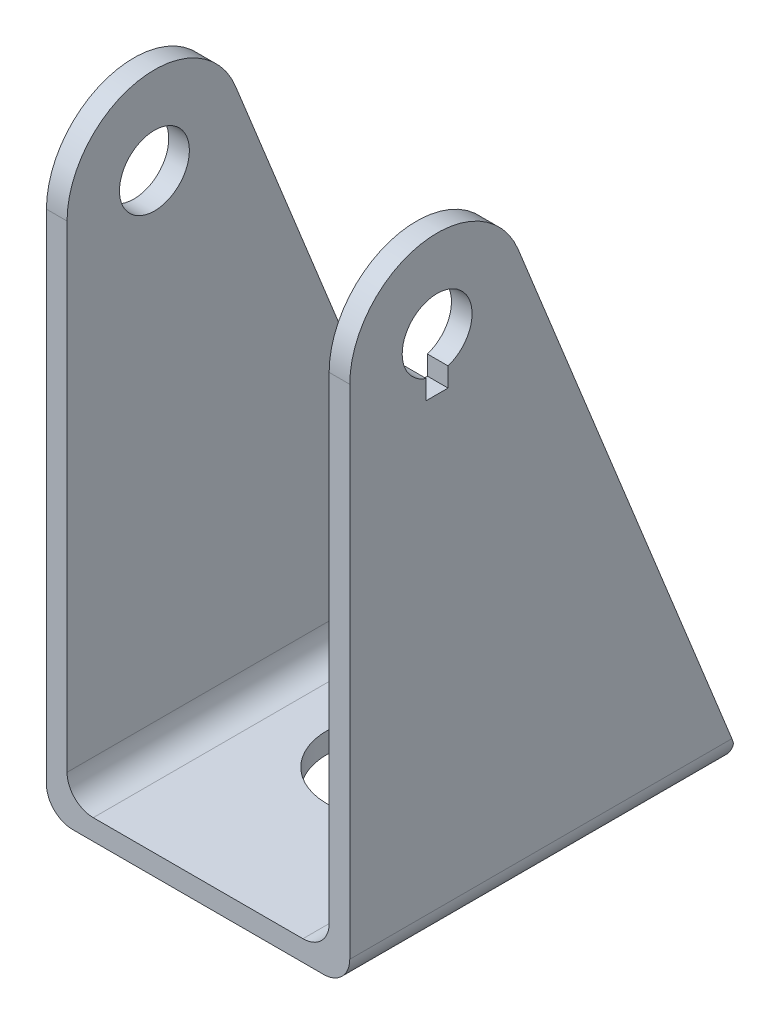
from build123d import *

# Parameters (mm, degrees)
CROQUIS1_R              = 4
SALIENTE_EXTRUIR1_DEPTH = 34.72
CROQUIS2_W              = 30
CROQUIS2_H              = 67.64
CORTAR_EXTRUIR1_DEPTH   = 90.67429063
REDONDEO1_R             = 3
CORTAR_EXTRUIR2_DEPTH   = 89.787215296
CROQUIS4_R              = 7.25
CORTAR_EXTRUIR3_DEPTH   = 88.844453439


with BuildPart() as part:
    # Croquis1 → Saliente-Extruir1 (new body)
    with BuildSketch(Plane(origin=(0, 0, 0), x_dir=(0, 0, -1), z_dir=(1, 0, 0))):
        with BuildLine():
            Line((0, 60), (0, 0))
            Line((0, 0), (44, 0))
            Line((44, 0), (44, 2.36))
            Line((44, 2.36), (19.275687183, 63.736526097))
            ThreePointArc((19.275687183, 63.736526097), (8.096959254, 69.817251953), (0, 60))
        make_face()
        with Locations((10, 60)):
            Circle(CROQUIS1_R, mode=Mode.SUBTRACT)
    extrude(amount=SALIENTE_EXTRUIR1_DEPTH)

    # Croquis2 → Cortar-Extruir1 (cut, through all)
    with BuildSketch(Plane.XY):
        with Locations((17.36, 36.18)):
            Rectangle(CROQUIS2_W, CROQUIS2_H)
    extrude(amount=-CORTAR_EXTRUIR1_DEPTH, mode=Mode.SUBTRACT)

    # Redondeo1
    redondeo1_edges = [part.edges().sort_by_distance(p)[0] for p in [
        (34.72, 0, -22),
        (0, 0, -22),
        (32.36, 2.36, -22),
        (2.36, 2.36, -22),
    ]]
    fillet(redondeo1_edges, radius=REDONDEO1_R)

    # Croquis3 → Cortar-Extruir2 (cut, through all)
    with BuildSketch(Plane.ZY.offset(-32.36)):
        with BuildLine():
            Line((-8.75, 54), (-8.75, 56.200328962))
            ThreePointArc((-8.75, 56.200328962), (-10, 56), (-11.25, 56.200328962))
            Line((-11.25, 56.200328962), (-11.25, 54))
            Line((-11.25, 54), (-8.75, 54))
        make_face()
    extrude(amount=-CORTAR_EXTRUIR2_DEPTH, mode=Mode.SUBTRACT)

    # Croquis4 → Cortar-Extruir3 (cut, through all)
    with BuildSketch(Plane(origin=(0, 2.36, 0), x_dir=(1, 0, 0), z_dir=(0, 1, 0))):
        with Locations(Location((17.36, 22, 0), (0, 0, 270))):
            Circle(CROQUIS4_R)
    extrude(amount=-CORTAR_EXTRUIR3_DEPTH, mode=Mode.SUBTRACT)


solid = part.part
